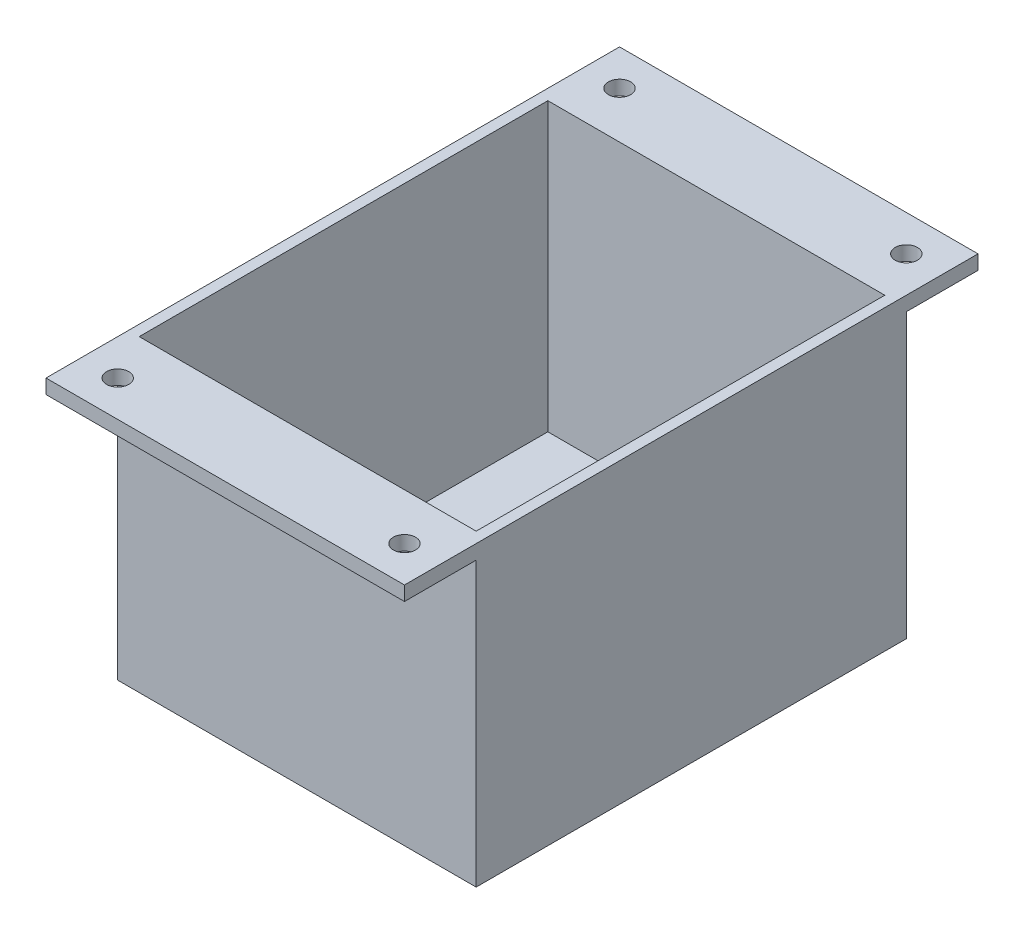
from build123d import *

# Parameters (mm, degrees)
SKETCH1_W           = 50
SKETCH1_H           = 60
SKETCH1_W_2         = 47
SKETCH1_H_2         = 57
BOSS_EXTRUDE6_DEPTH = 40
SKETCH7_W           = 50
SKETCH7_H           = 60
BOSS_EXTRUDE8_DEPTH = 1.5
SKETCH8_W           = 10
SKETCH8_H           = 2
BOSS_EXTRUDE9_DEPTH = 50
SKETCH9_R           = 1.55
CUT_EXTRUDE1_DEPTH  = 3


with BuildPart() as part:
    # Sketch1 → Boss-Extrude6 (new body)
    with BuildSketch(Plane(origin=(0, 0, 0), x_dir=(1, 0, 0), z_dir=(0, 1, 0))):
        Rectangle(SKETCH1_W, SKETCH1_H)
        Rectangle(SKETCH1_W_2, SKETCH1_H_2, mode=Mode.SUBTRACT)
    extrude(amount=BOSS_EXTRUDE6_DEPTH)

    # Sketch7 → Boss-Extrude8 (add)
    with BuildSketch(Plane.XZ):
        Rectangle(SKETCH7_W, SKETCH7_H)
    extrude(amount=BOSS_EXTRUDE8_DEPTH)

    # Sketch8 → Boss-Extrude9 (add)
    with BuildSketch(Plane(origin=(25, 0, 0), x_dir=(0, 0, -1), z_dir=(1, 0, 0))):
        with Locations((-35, 39)):
            Rectangle(SKETCH8_W, SKETCH8_H)
        with Locations((35, 39)):
            Rectangle(SKETCH8_W, SKETCH8_H)
    extrude(amount=-BOSS_EXTRUDE9_DEPTH)

    # Sketch9 → Cut-Extrude1 (cut)
    with BuildSketch(Plane(origin=(0, 40, 0), x_dir=(1, 0, 0), z_dir=(0, 1, 0))):
        with Locations(Location((-20, 35, 0), (0, 0, 270))):
            Circle(SKETCH9_R)
        with Locations(Location((20, 35, 0), (0, 0, 270))):
            Circle(SKETCH9_R)
        with Locations(Location((20, -35, 0), (0, 0, 270))):
            Circle(SKETCH9_R)
        with Locations(Location((-20, -35, 0), (0, 0, 270))):
            Circle(SKETCH9_R)
    extrude(amount=-CUT_EXTRUDE1_DEPTH, mode=Mode.SUBTRACT)


solid = part.part
